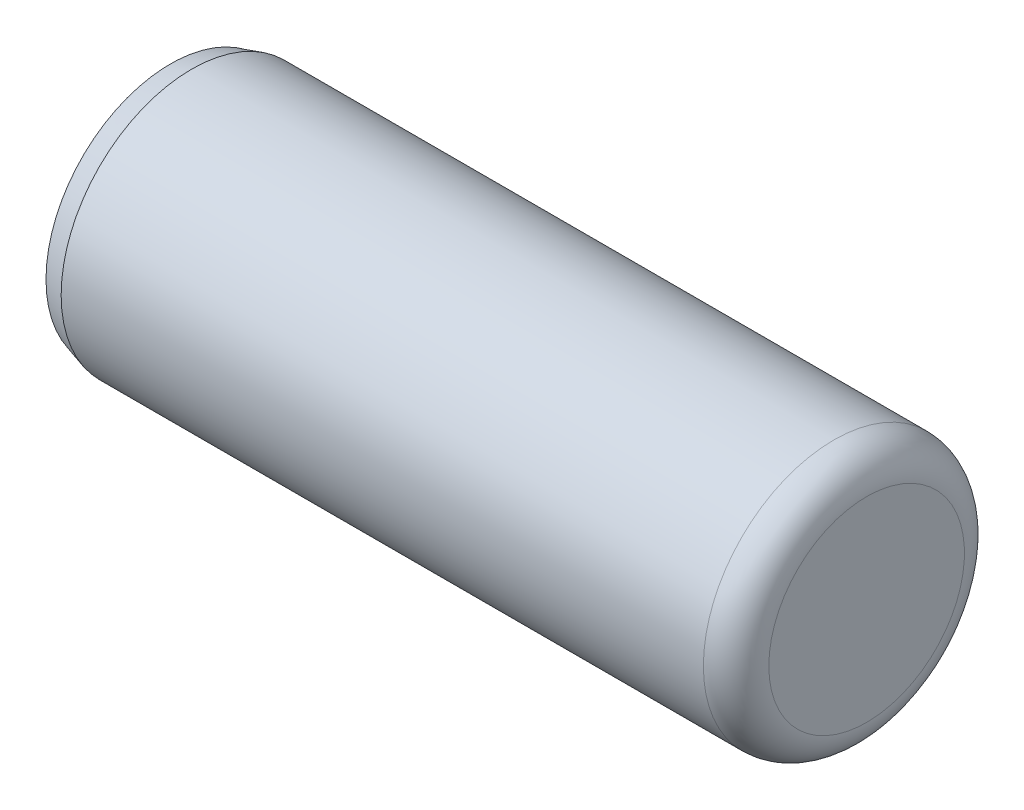
from build123d import *


with BuildPart() as part:
    # Sketch3 → Revolve1 (revolve)
    with BuildSketch(Plane.XY, mode=Mode.PRIVATE) as revolve1_sk:
        with BuildLine():
            Line((12.7, 3.5687), (12.7, 0))
            Line((12.7, 0), (-12.7, 0))
            Line((-12.7, 0), (-12.7, 4.54025))
            Line((-12.7, 4.54025), (-11.92492214, 4.7625))
            Line((-11.92492214, 4.7625), (11.5062, 4.7625))
            ThreePointArc((11.5062, 4.7625), (12.350344075, 4.412844075), (12.7, 3.5687))
        make_face()
    revolve(revolve1_sk.sketch.rotate(Axis((-12.7, 0, 0), (1, 0, 0)), 90), axis=Axis((-12.7, 0, 0), (1, 0, 0)))


solid = part.part
